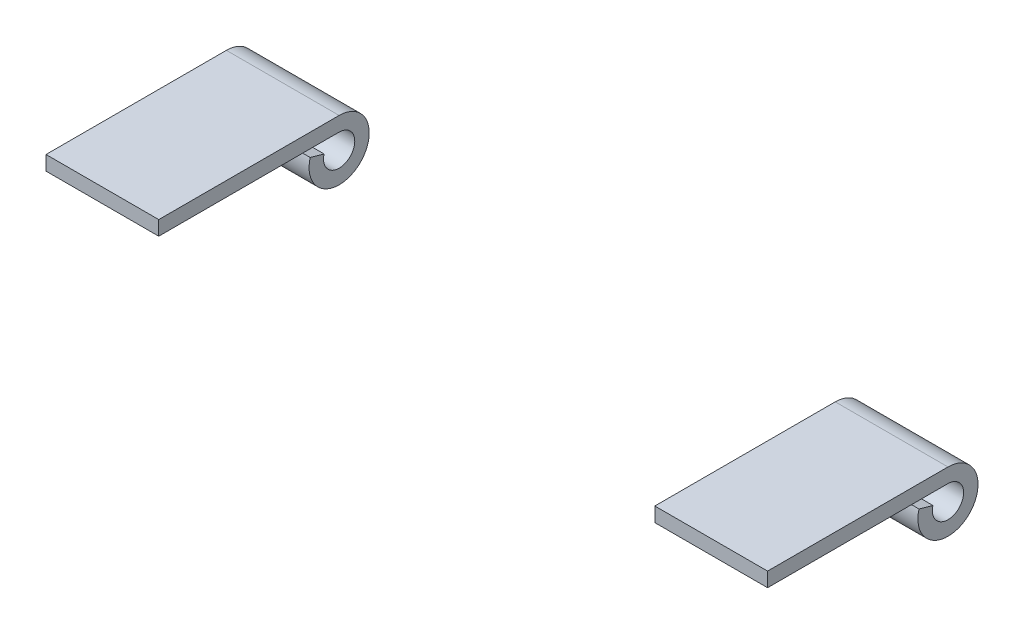
from build123d import *

# Parameters (mm, degrees)
BOSS_EXTRUDE1_START = 104.775
BOSS_EXTRUDE1_DEPTH = 47.625
BOSS_EXTRUDE2_START = -152.4
BOSS_EXTRUDE2_DEPTH = 47.625


with BuildPart() as part:
    # Sketch1 → Boss-Extrude1 (new body)
    with BuildSketch(Plane(origin=(0, 0, 0), x_dir=(0, 0, -1), z_dir=(1, 0, 0)).offset(BOSS_EXTRUDE1_START)):
        with BuildLine():
            Line((1540.78633762, -31.496), (1464.58633762, -31.496))
            Line((1464.58633762, -31.496), (1464.58633762, -25.4))
            Line((1464.58633762, -25.4), (1540.78633762, -25.4))
            ThreePointArc((1540.78633762, -25.4), (1548.459071813, -48.220234681), (1528.558011528, -34.671))
            Line((1528.558011528, -34.671), (1534.427608052, -36.31692))
            ThreePointArc((1534.427608052, -36.31692), (1544.7761594, -43.362522034), (1540.78633762, -31.496))
        make_face()
    extrude(amount=BOSS_EXTRUDE1_DEPTH)


with BuildPart() as body_2:
    # Sketch1<2> → Boss-Extrude2 (new body)
    with BuildSketch(Plane(origin=(0, 0, 0), x_dir=(0, 0, -1), z_dir=(1, 0, 0)).offset(BOSS_EXTRUDE2_START)):
        with BuildLine():
            Line((1540.78633762, -31.496), (1464.58633762, -31.496))
            Line((1464.58633762, -31.496), (1464.58633762, -25.4))
            Line((1464.58633762, -25.4), (1540.78633762, -25.4))
            ThreePointArc((1540.78633762, -25.4), (1548.459071813, -48.220234681), (1528.558011528, -34.671))
            Line((1528.558011528, -34.671), (1534.427608052, -36.31692))
            ThreePointArc((1534.427608052, -36.31692), (1544.7761594, -43.362522034), (1540.78633762, -31.496))
        make_face()
    extrude(amount=BOSS_EXTRUDE2_DEPTH)


solid = Compound([part.part, body_2.part])
